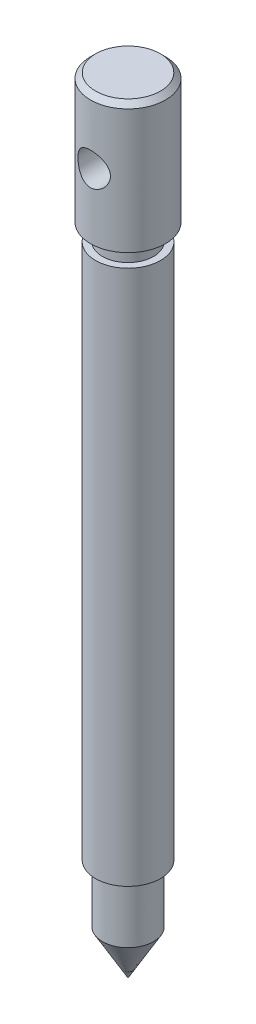
from build123d import *

# Parameters (mm, degrees)
CORTAR_EXTRUIR1_DEPTH      = 231.52548666
CORTAR_EXTRUIR1_DEPTH_BACK = 231.52548666
CROQUIS2_R                 = 4.7625
CHAFL_N1_SIZE              = 1.5


with BuildPart() as part:
    # Croquis1 → Revolución1 (revolve)
    with BuildSketch(Plane.XY, mode=Mode.PRIVATE) as revoluci_n1_sk:
        Polygon((0, 0), (7.5, 12.990381057), (7.5, 30), (9.525, 30), (9.525, 187), (7.5, 187), (7.5, 192), (11, 192), (11, 230), (0, 230), align=None)
    revolve(revoluci_n1_sk.sketch.rotate(Axis((0, 0, 0), (0, 1, 0)), 90), axis=Axis((0, 0, 0), (0, 1, 0)))

    # Croquis2 → Cortar-Extruir1 (cut, two sides: drawn at the far end of the back side and taken through both)
    with BuildSketch(Plane.XY.offset(-CORTAR_EXTRUIR1_DEPTH_BACK)):
        with Locations((0, 211)):
            Circle(CROQUIS2_R)
    extrude(amount=CORTAR_EXTRUIR1_DEPTH + CORTAR_EXTRUIR1_DEPTH_BACK, mode=Mode.SUBTRACT)

    # Chaflán1
    chafl_n1_edges = [part.edges().sort_by_distance(p)[0] for p in [
        (0, 230, 11),
    ]]
    chamfer(chafl_n1_edges, length=CHAFL_N1_SIZE)


solid = part.part
